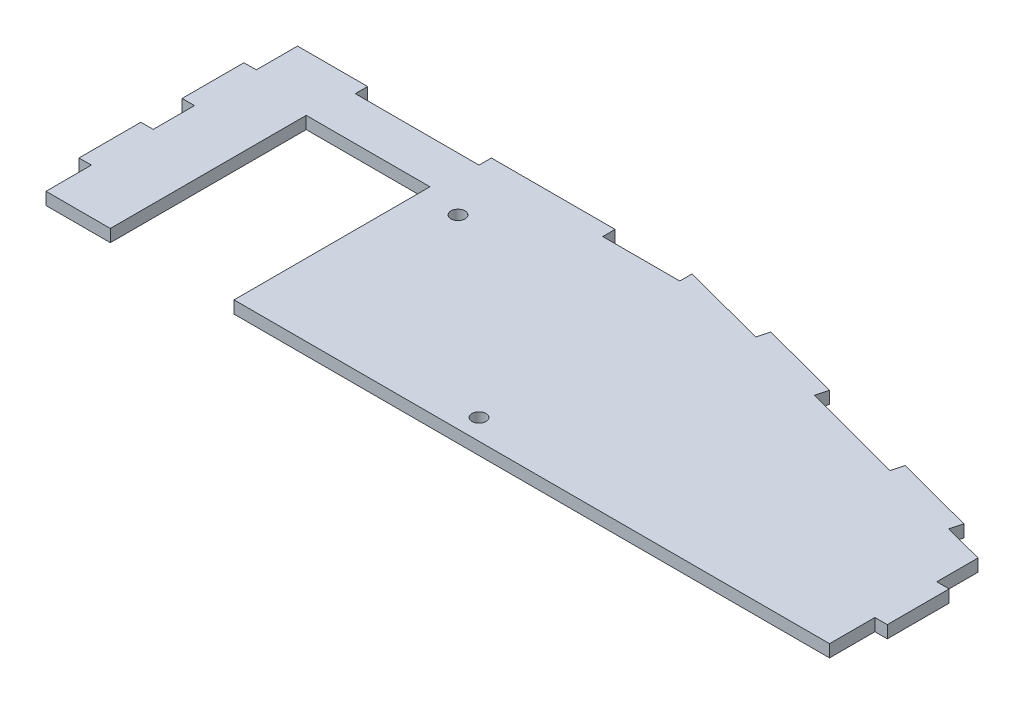
from build123d import *

# Parameters (mm, degrees)
SKETCH1_W           = 196
SKETCH1_H           = 61
BOSS_EXTRUDE1_DEPTH = 3
SKETCH2_R           = 1.7
SKETCH2_W           = 30
SKETCH2_H           = 47.5
SKETCH2_W_2         = 3
SKETCH2_H_2         = 10
SKETCH2_H_3         = 11
SKETCH2_H_4         = 3
CUT_EXTRUDE1_DEPTH  = 3
CUT_EXTRUDE2_DEPTH  = 10
BOSS_EXTRUDE2_DEPTH = 3


with BuildPart() as part:
    # Sketch1 → Boss-Extrude1 (new body)
    with BuildSketch(Plane(origin=(0, 0, 0), x_dir=(1, 0, 0), z_dir=(0, 1, 0))):
        Rectangle(SKETCH1_W, SKETCH1_H)
    extrude(amount=BOSS_EXTRUDE1_DEPTH)

    # Sketch2 → Cut-Extrude1 (cut)
    with BuildSketch(Plane(origin=(0, 3, 0), x_dir=(1, 0, 0), z_dir=(0, 1, 0))):
        with Locations(Location((-40.09, 14.5, 0), (0, 0, 270))):
            Circle(SKETCH2_R)
        with Locations(Location((5, -25.5, 0), (0, 0, 270))):
            Circle(SKETCH2_R)
        with Locations((-64.4, -6.75)):
            Rectangle(SKETCH2_W, SKETCH2_H)
        with Locations((-96.5, 25.5)):
            Rectangle(SKETCH2_W_2, SKETCH2_H_2)
        with Locations((-96.5, 0.5)):
            Rectangle(SKETCH2_W_2, SKETCH2_H_2)
        with Locations((-96.5, -25)):
            Rectangle(SKETCH2_W_2, SKETCH2_H_3)
        with Locations((96.5, 0.5)):
            Rectangle(SKETCH2_W_2, SKETCH2_H_2)
        with Locations((96.5, -25)):
            Rectangle(SKETCH2_W_2, SKETCH2_H_3)
        with Locations((-3, 29)):
            Rectangle(SKETCH2_W, SKETCH2_H_4)
        with Locations((-63, 29)):
            Rectangle(SKETCH2_W, SKETCH2_H_4)
        with Locations((57, 29)):
            Rectangle(SKETCH2_W, SKETCH2_H_4)
        with Locations((96.5, 25.5)):
            Rectangle(SKETCH2_W_2, SKETCH2_H_2)
    extrude(amount=-CUT_EXTRUDE1_DEPTH, mode=Mode.SUBTRACT)

    # Sketch3 → Cut-Extrude2 (cut)
    with BuildSketch(Plane(origin=(0, 3, 0), x_dir=(1, 0, 0), z_dir=(0, 1, 0))):
        Polygon((12, 30.5), (98, 30.5), (98, 5.5), (95, 5.5), (85.333795578, 8.062126473), (86.10243352, 10.9619878), (66.770024675, 16.086240747), (66.001386733, 13.18637942), (40.998613267, 19.81362058), (41.767251209, 22.713481907), (22.434842364, 27.837734853), (21.666204422, 24.937873527), (12, 27.5), align=None)
    extrude(amount=-CUT_EXTRUDE2_DEPTH, mode=Mode.SUBTRACT)

    # Sketch5 → Boss-Extrude2 (add)
    with BuildSketch(Plane(origin=(0, 3, 0), x_dir=(1, 0, 0), z_dir=(0, 1, 0))):
        Polygon((12, 27.5), (0.681818182, 30.5), (0.681818182, 27.5), align=None)
    extrude(amount=-BOSS_EXTRUDE2_DEPTH)


solid = part.part
